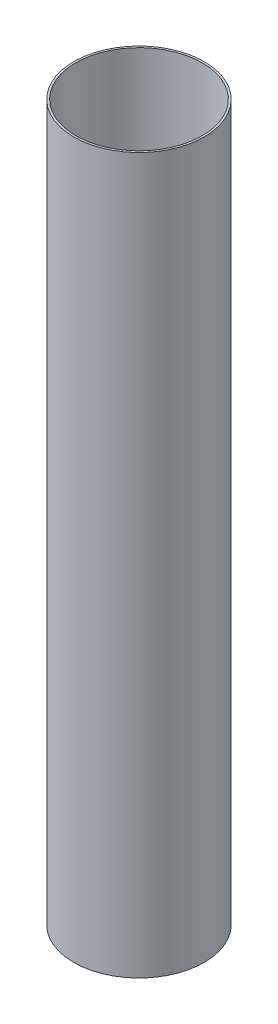
from build123d import *

# Parameters (mm, degrees)
SKETCH1_R           = 51.105
BOSS_EXTRUDE1_DEPTH = 560
SKETCH3_R           = 49.53
CUT_EXTRUDE1_DEPTH  = 565.644527158


with BuildPart() as part:
    # Sketch1 → Boss-Extrude1 (new body)
    with BuildSketch(Plane(origin=(0, 0, 0), x_dir=(1, 0, 0), z_dir=(0, 1, 0))):
        with Locations(Location((0, 0, 0), (0, 0, 270))):
            Circle(SKETCH1_R)
    extrude(amount=BOSS_EXTRUDE1_DEPTH)

    # Sketch3 → Cut-Extrude1 (cut, through all)
    with BuildSketch(Plane.XZ):
        with Locations(Location((0, 0, 0), (0, 0, 270))):
            Circle(SKETCH3_R)
    extrude(amount=-CUT_EXTRUDE1_DEPTH, mode=Mode.SUBTRACT)


solid = part.part
